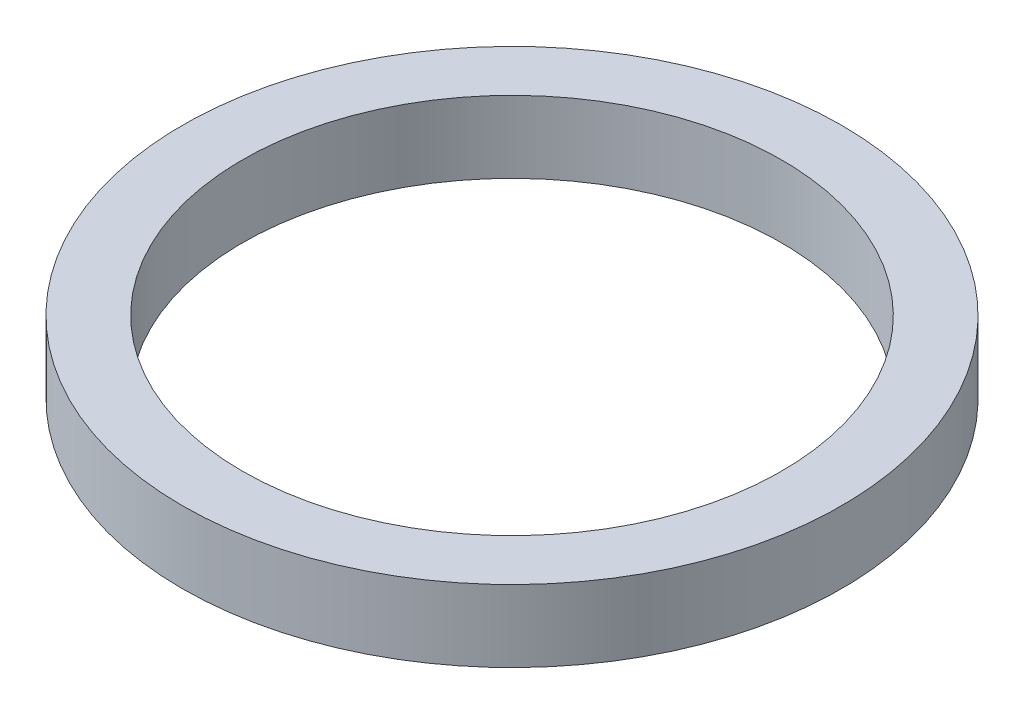
from build123d import *

# Parameters (mm, degrees)
SKETCH1_R           = 27.5
SKETCH1_R_2         = 22.5
BOSS_EXTRUDE1_DEPTH = 6


with BuildPart() as part:
    # Sketch1 → Boss-Extrude1 (new body)
    with BuildSketch(Plane(origin=(0, 0, 0), x_dir=(1, 0, 0), z_dir=(0, 1, 0))):
        with Locations(Location((0, 0, 0), (0, 0, 270))):
            Circle(SKETCH1_R)
        with Locations(Location((0, 0, 0), (0, 0, 270))):
            Circle(SKETCH1_R_2, mode=Mode.SUBTRACT)
    extrude(amount=BOSS_EXTRUDE1_DEPTH)


solid = part.part
